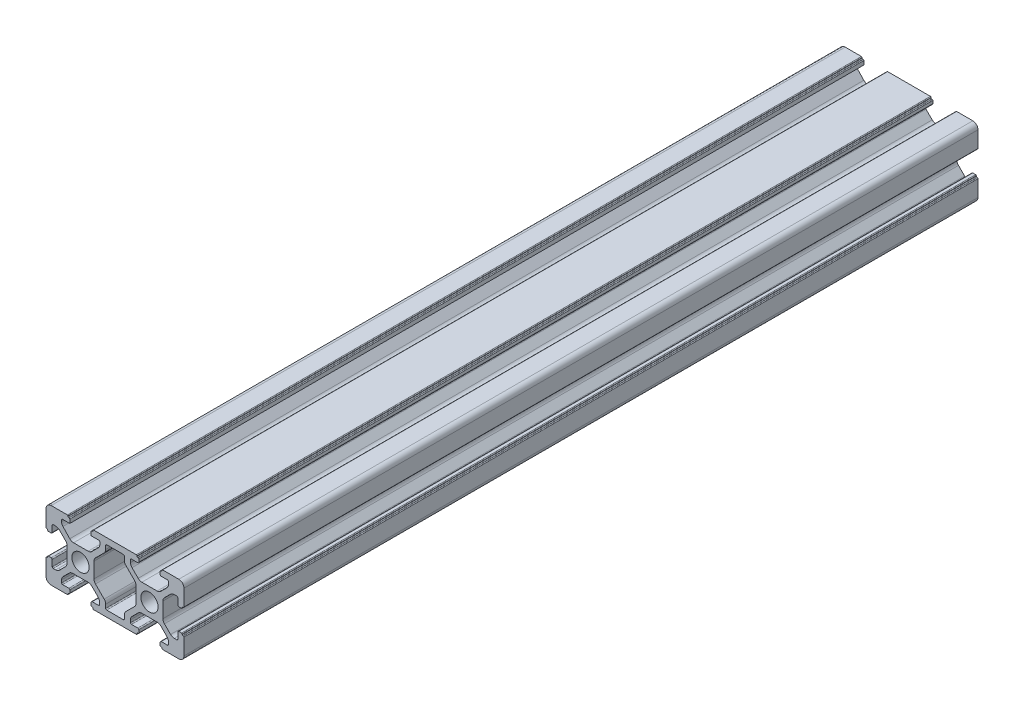
from build123d import *

# Parameters (mm, degrees)
SKETCH1_R           = 2.5
BOSS_EXTRUDE2_DEPTH = 230.2


with BuildPart() as part:
    # Sketch1 → Boss-Extrude2 (new body)
    with BuildSketch(Plane.XY):
        with BuildLine():
            Line((1.5, 0), (6.2, 0))
            ThreePointArc((6.2, 0), (6.341421356, 0.058578644), (6.4, 0.2))
            Line((6.4, 0.2), (6.4, 0.3))
            ThreePointArc((6.4, 0.3), (6.458578644, 0.441421356), (6.6, 0.5))
            Line((6.6, 0.5), (6.7, 0.5))
            ThreePointArc((6.7, 0.5), (6.841421356, 0.558578644), (6.9, 0.7))
            Line((6.9, 0.7), (6.9, 1.5))
            ThreePointArc((6.9, 1.5), (6.812132034, 1.712132034), (6.6, 1.8))
            Line((6.6, 1.8), (4.8, 1.8))
            ThreePointArc((4.8, 1.8), (4.587867966, 1.887867966), (4.5, 2.1))
            Line((4.5, 2.1), (4.5, 2.818019485))
            ThreePointArc((4.5, 2.818019485), (4.614180701, 3.392044633), (4.939339828, 3.878679656))
            Line((4.939339828, 3.878679656), (6.721320344, 5.660660172))
            ThreePointArc((6.721320344, 5.660660172), (7.207955367, 5.985819299), (7.781980515, 6.1))
            Line((7.781980515, 6.1), (12.218019485, 6.1))
            ThreePointArc((12.218019485, 6.1), (12.792044633, 5.985819299), (13.278679656, 5.660660172))
            Line((13.278679656, 5.660660172), (15.060660172, 3.878679656))
            ThreePointArc((15.060660172, 3.878679656), (15.385819299, 3.392044633), (15.5, 2.818019485))
            Line((15.5, 2.818019485), (15.5, 2.1))
            ThreePointArc((15.5, 2.1), (15.412132034, 1.887867966), (15.2, 1.8))
            Line((15.2, 1.8), (13.4, 1.8))
            ThreePointArc((13.4, 1.8), (13.187867966, 1.712132034), (13.1, 1.5))
            Line((13.1, 1.5), (13.1, 0.7))
            ThreePointArc((13.1, 0.7), (13.158578644, 0.558578644), (13.3, 0.5))
            Line((13.3, 0.5), (13.4, 0.5))
            ThreePointArc((13.4, 0.5), (13.541421356, 0.441421356), (13.6, 0.3))
            Line((13.6, 0.3), (13.6, 0.2))
            ThreePointArc((13.6, 0.2), (13.658578644, 0.058578644), (13.8, 0))
            Line((13.8, 0), (26.2, 0))
            ThreePointArc((26.2, 0), (26.341421356, 0.058578644), (26.4, 0.2))
            Line((26.4, 0.2), (26.4, 0.3))
            ThreePointArc((26.4, 0.3), (26.458578644, 0.441421356), (26.6, 0.5))
            Line((26.6, 0.5), (26.7, 0.5))
            ThreePointArc((26.7, 0.5), (26.841421356, 0.558578644), (26.9, 0.7))
            Line((26.9, 0.7), (26.9, 1.5))
            ThreePointArc((26.9, 1.5), (26.812132034, 1.712132034), (26.6, 1.8))
            Line((26.6, 1.8), (24.8, 1.8))
            ThreePointArc((24.8, 1.8), (24.587867966, 1.887867966), (24.5, 2.1))
            Line((24.5, 2.1), (24.5, 2.818019485))
            ThreePointArc((24.5, 2.818019485), (24.614180701, 3.392044633), (24.939339828, 3.878679656))
            Line((24.939339828, 3.878679656), (26.721320344, 5.660660172))
            ThreePointArc((26.721320344, 5.660660172), (27.207955367, 5.985819299), (27.781980515, 6.1))
            Line((27.781980515, 6.1), (32.218019485, 6.1))
            ThreePointArc((32.218019485, 6.1), (32.792044633, 5.985819299), (33.278679656, 5.660660172))
            Line((33.278679656, 5.660660172), (35.060660172, 3.878679656))
            ThreePointArc((35.060660172, 3.878679656), (35.385819299, 3.392044633), (35.5, 2.818019485))
            Line((35.5, 2.818019485), (35.5, 2.1))
            ThreePointArc((35.5, 2.1), (35.412132034, 1.887867966), (35.2, 1.8))
            Line((35.2, 1.8), (33.4, 1.8))
            ThreePointArc((33.4, 1.8), (33.187867966, 1.712132034), (33.1, 1.5))
            Line((33.1, 1.5), (33.1, 0.7))
            ThreePointArc((33.1, 0.7), (33.158578644, 0.558578644), (33.3, 0.5))
            Line((33.3, 0.5), (33.4, 0.5))
            ThreePointArc((33.4, 0.5), (33.541421356, 0.441421356), (33.6, 0.3))
            Line((33.6, 0.3), (33.6, 0.2))
            ThreePointArc((33.6, 0.2), (33.658578644, 0.058578644), (33.8, 0))
            Line((33.8, 0), (38.5, 0))
            ThreePointArc((38.5, 0), (39.560660172, 0.439339828), (40, 1.5))
            Line((40, 1.5), (40, 6.2))
            ThreePointArc((40, 6.2), (39.941421356, 6.341421356), (39.8, 6.4))
            Line((39.8, 6.4), (39.7, 6.4))
            ThreePointArc((39.7, 6.4), (39.558578644, 6.458578644), (39.5, 6.6))
            Line((39.5, 6.6), (39.5, 6.7))
            ThreePointArc((39.5, 6.7), (39.441421356, 6.841421356), (39.3, 6.9))
            Line((39.3, 6.9), (38.5, 6.9))
            ThreePointArc((38.5, 6.9), (38.287867966, 6.812132034), (38.2, 6.6))
            Line((38.2, 6.6), (38.2, 4.8))
            ThreePointArc((38.2, 4.8), (38.112132034, 4.587867966), (37.9, 4.5))
            Line((37.9, 4.5), (37.181980515, 4.5))
            ThreePointArc((37.181980515, 4.5), (36.607955367, 4.614180701), (36.121320344, 4.939339828))
            Line((36.121320344, 4.939339828), (34.339339828, 6.721320344))
            ThreePointArc((34.339339828, 6.721320344), (34.014180701, 7.207955367), (33.9, 7.781980515))
            Line((33.9, 7.781980515), (33.9, 12.218019485))
            ThreePointArc((33.9, 12.218019485), (34.014180701, 12.792044633), (34.339339828, 13.278679656))
            Line((34.339339828, 13.278679656), (36.121320344, 15.060660172))
            ThreePointArc((36.121320344, 15.060660172), (36.607955367, 15.385819299), (37.181980515, 15.5))
            Line((37.181980515, 15.5), (37.9, 15.5))
            ThreePointArc((37.9, 15.5), (38.112132034, 15.412132034), (38.2, 15.2))
            Line((38.2, 15.2), (38.2, 13.4))
            ThreePointArc((38.2, 13.4), (38.287867966, 13.187867966), (38.5, 13.1))
            Line((38.5, 13.1), (39.3, 13.1))
            ThreePointArc((39.3, 13.1), (39.441421356, 13.158578644), (39.5, 13.3))
            Line((39.5, 13.3), (39.5, 13.4))
            ThreePointArc((39.5, 13.4), (39.558578644, 13.541421356), (39.7, 13.6))
            Line((39.7, 13.6), (39.8, 13.6))
            ThreePointArc((39.8, 13.6), (39.941421356, 13.658578644), (40, 13.8))
            Line((40, 13.8), (40, 18.5))
            ThreePointArc((40, 18.5), (39.560660172, 19.560660172), (38.5, 20))
            Line((38.5, 20), (33.8, 20))
            ThreePointArc((33.8, 20), (33.658578644, 19.941421356), (33.6, 19.8))
            Line((33.6, 19.8), (33.6, 19.7))
            ThreePointArc((33.6, 19.7), (33.541421356, 19.558578644), (33.4, 19.5))
            Line((33.4, 19.5), (33.3, 19.5))
            ThreePointArc((33.3, 19.5), (33.158578644, 19.441421356), (33.1, 19.3))
            Line((33.1, 19.3), (33.1, 18.5))
            ThreePointArc((33.1, 18.5), (33.187867966, 18.287867966), (33.4, 18.2))
            Line((33.4, 18.2), (35.2, 18.2))
            ThreePointArc((35.2, 18.2), (35.412132034, 18.112132034), (35.5, 17.9))
            Line((35.5, 17.9), (35.5, 17.181980515))
            ThreePointArc((35.5, 17.181980515), (35.385819299, 16.607955367), (35.060660172, 16.121320344))
            Line((35.060660172, 16.121320344), (33.278679656, 14.339339828))
            ThreePointArc((33.278679656, 14.339339828), (32.792044633, 14.014180701), (32.218019485, 13.9))
            Line((32.218019485, 13.9), (27.781980515, 13.9))
            ThreePointArc((27.781980515, 13.9), (27.207955367, 14.014180701), (26.721320344, 14.339339828))
            Line((26.721320344, 14.339339828), (24.939339828, 16.121320344))
            ThreePointArc((24.939339828, 16.121320344), (24.614180701, 16.607955367), (24.5, 17.181980515))
            Line((24.5, 17.181980515), (24.5, 17.9))
            ThreePointArc((24.5, 17.9), (24.587867966, 18.112132034), (24.8, 18.2))
            Line((24.8, 18.2), (26.6, 18.2))
            ThreePointArc((26.6, 18.2), (26.812132034, 18.287867966), (26.9, 18.5))
            Line((26.9, 18.5), (26.9, 19.3))
            ThreePointArc((26.9, 19.3), (26.841421356, 19.441421356), (26.7, 19.5))
            Line((26.7, 19.5), (26.6, 19.5))
            ThreePointArc((26.6, 19.5), (26.458578644, 19.558578644), (26.4, 19.7))
            Line((26.4, 19.7), (26.4, 19.8))
            ThreePointArc((26.4, 19.8), (26.341421356, 19.941421356), (26.2, 20))
            Line((26.2, 20), (13.8, 20))
            ThreePointArc((13.8, 20), (13.658578644, 19.941421356), (13.6, 19.8))
            Line((13.6, 19.8), (13.6, 19.7))
            ThreePointArc((13.6, 19.7), (13.541421356, 19.558578644), (13.4, 19.5))
            Line((13.4, 19.5), (13.3, 19.5))
            ThreePointArc((13.3, 19.5), (13.158578644, 19.441421356), (13.1, 19.3))
            Line((13.1, 19.3), (13.1, 18.2))
            Line((13.1, 18.2), (15.3, 18.2))
            ThreePointArc((15.3, 18.2), (15.512132034, 18.112132034), (15.6, 17.9))
            Line((15.6, 17.9), (15.6, 17.281980515))
            ThreePointArc((15.6, 17.281980515), (15.485819299, 16.707955367), (15.160660172, 16.221320344))
            Line((15.160660172, 16.221320344), (13.278679656, 14.339339828))
            ThreePointArc((13.278679656, 14.339339828), (12.792044633, 14.014180701), (12.218019485, 13.9))
            Line((12.218019485, 13.9), (7.986375635, 13.9))
            ThreePointArc((7.986375635, 13.9), (7.393381044, 14.022191082), (6.896997987, 14.36885678))
            Line((6.896997987, 14.36885678), (4.910622352, 16.467414163))
            ThreePointArc((4.910622352, 16.467414163), (4.606431474, 16.943609851), (4.5, 17.498557383))
            Line((4.5, 17.498557383), (4.5, 17.9))
            ThreePointArc((4.5, 17.9), (4.587867966, 18.112132034), (4.8, 18.2))
            Line((4.8, 18.2), (6.9, 18.2))
            Line((6.9, 18.2), (6.9, 19.3))
            ThreePointArc((6.9, 19.3), (6.841421356, 19.441421356), (6.7, 19.5))
            Line((6.7, 19.5), (6.6, 19.5))
            ThreePointArc((6.6, 19.5), (6.458578644, 19.558578644), (6.4, 19.7))
            Line((6.4, 19.7), (6.4, 19.8))
            ThreePointArc((6.4, 19.8), (6.341421356, 19.941421356), (6.2, 20))
            Line((6.2, 20), (1.5, 20))
            ThreePointArc((1.5, 20), (0.439339828, 19.560660172), (0, 18.5))
            Line((0, 18.5), (0, 13.8))
            ThreePointArc((0, 13.8), (0.058578644, 13.658578644), (0.2, 13.6))
            Line((0.2, 13.6), (0.3, 13.6))
            ThreePointArc((0.3, 13.6), (0.441421356, 13.541421356), (0.5, 13.4))
            Line((0.5, 13.4), (0.5, 13.3))
            ThreePointArc((0.5, 13.3), (0.558578644, 13.158578644), (0.7, 13.1))
            Line((0.7, 13.1), (1.5, 13.1))
            ThreePointArc((1.5, 13.1), (1.712132034, 13.187867966), (1.8, 13.4))
            Line((1.8, 13.4), (1.8, 15.2))
            ThreePointArc((1.8, 15.2), (1.887867966, 15.412132034), (2.1, 15.5))
            Line((2.1, 15.5), (2.818019485, 15.5))
            ThreePointArc((2.818019485, 15.5), (3.392044633, 15.385819299), (3.878679656, 15.060660172))
            Line((3.878679656, 15.060660172), (5.660660172, 13.278679656))
            ThreePointArc((5.660660172, 13.278679656), (5.985819299, 12.792044633), (6.1, 12.218019485))
            Line((6.1, 12.218019485), (6.1, 7.781980515))
            ThreePointArc((6.1, 7.781980515), (5.985819299, 7.207955367), (5.660660172, 6.721320344))
            Line((5.660660172, 6.721320344), (3.878679656, 4.939339828))
            ThreePointArc((3.878679656, 4.939339828), (3.392044633, 4.614180701), (2.818019485, 4.5))
            Line((2.818019485, 4.5), (2.1, 4.5))
            ThreePointArc((2.1, 4.5), (1.887867966, 4.587867966), (1.8, 4.8))
            Line((1.8, 4.8), (1.8, 6.6))
            ThreePointArc((1.8, 6.6), (1.712132034, 6.812132034), (1.5, 6.9))
            Line((1.5, 6.9), (0.7, 6.9))
            ThreePointArc((0.7, 6.9), (0.558578644, 6.841421356), (0.5, 6.7))
            Line((0.5, 6.7), (0.5, 6.6))
            ThreePointArc((0.5, 6.6), (0.441421356, 6.458578644), (0.3, 6.4))
            Line((0.3, 6.4), (0.2, 6.4))
            ThreePointArc((0.2, 6.4), (0.058578644, 6.341421356), (0, 6.2))
            Line((0, 6.2), (0, 1.5))
            ThreePointArc((0, 1.5), (0.439339828, 0.439339828), (1.5, 0))
        make_face()
        with Locations((10, 10)):
            Circle(SKETCH1_R, mode=Mode.SUBTRACT)
        with Locations((30, 10)):
            Circle(SKETCH1_R, mode=Mode.SUBTRACT)
        with BuildLine():
            Line((17.6, 1.8), (22.4, 1.8))
            ThreePointArc((22.4, 1.8), (22.612132034, 1.887867966), (22.7, 2.1))
            Line((22.7, 2.1), (22.7, 3.139339828))
            ThreePointArc((22.7, 3.139339828), (22.814180701, 3.713364977), (23.139339828, 4.2))
            Line((23.139339828, 4.2), (25.660660172, 6.721320344))
            ThreePointArc((25.660660172, 6.721320344), (25.985819299, 7.207955367), (26.1, 7.781980515))
            Line((26.1, 7.781980515), (26.1, 12.218019485))
            ThreePointArc((26.1, 12.218019485), (25.985819299, 12.792044633), (25.660660172, 13.278679656))
            Line((25.660660172, 13.278679656), (23.139339828, 15.8))
            ThreePointArc((23.139339828, 15.8), (22.814180701, 16.286635023), (22.7, 16.860660172))
            Line((22.7, 16.860660172), (22.7, 17.9))
            ThreePointArc((22.7, 17.9), (22.612132034, 18.112132034), (22.4, 18.2))
            Line((22.4, 18.2), (17.6, 18.2))
            ThreePointArc((17.6, 18.2), (17.387867966, 18.112132034), (17.3, 17.9))
            Line((17.3, 17.9), (17.3, 16.860660172))
            ThreePointArc((17.3, 16.860660172), (17.185819299, 16.286635023), (16.860660172, 15.8))
            Line((16.860660172, 15.8), (14.339339828, 13.278679656))
            ThreePointArc((14.339339828, 13.278679656), (14.014180701, 12.792044633), (13.9, 12.218019485))
            Line((13.9, 12.218019485), (13.9, 7.781980515))
            ThreePointArc((13.9, 7.781980515), (14.014180701, 7.207955367), (14.339339828, 6.721320344))
            Line((14.339339828, 6.721320344), (16.860660172, 4.2))
            ThreePointArc((16.860660172, 4.2), (17.185819299, 3.713364977), (17.3, 3.139339828))
            Line((17.3, 3.139339828), (17.3, 2.1))
            ThreePointArc((17.3, 2.1), (17.387867966, 1.887867966), (17.6, 1.8))
        make_face(mode=Mode.SUBTRACT)
    extrude(amount=BOSS_EXTRUDE2_DEPTH)


solid = part.part
